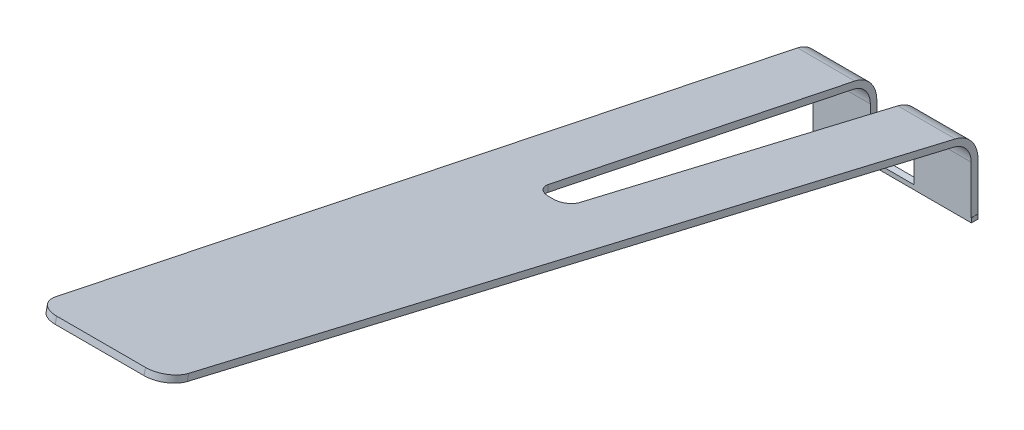
from build123d import *

# Parameters (mm, degrees)
LEVER_DEPTH      = 1.8
LEVER_DEPTH_BACK = 1.8
CUT_DEPTH        = 15.439772455
FILLET_1_R       = 0.5


with BuildPart() as part:
    # Эскиз1 → Lever (new, two sides: drawn at the far end of the back side and taken through both)
    with BuildSketch(Plane(origin=(2.85, 0, 0), x_dir=(0, 0, -1), z_dir=(1, 0, 0)).offset(-LEVER_DEPTH_BACK)):
        with BuildLine():
            Line((5.55, 4.85), (5.55, 6.042820323))
            ThreePointArc((5.55, 6.042820323), (5.440072487, 6.355619708), (5.158626179, 6.530878059))
            Line((5.158626179, 6.530878059), (-12.45, 10.45))
            Line((-12.45, 10.45), (-12.417412146, 10.596417321))
            Line((-12.417412146, 10.596417321), (5.191214033, 6.677295379))
            ThreePointArc((5.191214033, 6.677295379), (5.557094233, 6.449459523), (5.7, 6.042820323))
            Line((5.7, 6.042820323), (5.7, 4.85))
            Line((5.7, 4.85), (5.55, 4.85))
        make_face()
    extrude(amount=LEVER_DEPTH + LEVER_DEPTH_BACK)

    # Эскиз2 → Cut (cut, through all)
    with BuildSketch(Plane(origin=(0, 4.95, 0), x_dir=(1, 0, 0), z_dir=(0, 1, 0))):
        Polygon((1.05, 5.8), (1.35, -12.45), (1.05, -12.45), align=None)
        Polygon((4.65, 5.8), (4.65, -12.45), (4.35, -12.45), align=None)
        with BuildLine():
            Line((2.35, 5.8), (3.35, 5.8))
            Line((3.35, 5.8), (3.20551955, -1.905624011))
            ThreePointArc((3.20551955, -1.905624011), (3.115706509, -2.11411119), (2.90557227, -2.2))
            Line((2.90557227, -2.2), (2.79442773, -2.2))
            ThreePointArc((2.79442773, -2.2), (2.584293491, -2.11411119), (2.49448045, -1.905624011))
            Line((2.49448045, -1.905624011), (2.35, 5.8))
        make_face()
    extrude(amount=CUT_DEPTH, mode=Mode.SUBTRACT)

    # Скругление1
    fillet_1_edges = [part.edges().sort_by_distance(p)[0] for p in [
        (4.350267845, 10.52320866, 12.433706073),
        (1.349732155, 10.52320866, 12.433706073),
    ]]
    fillet(fillet_1_edges, radius=FILLET_1_R)


solid = part.part
